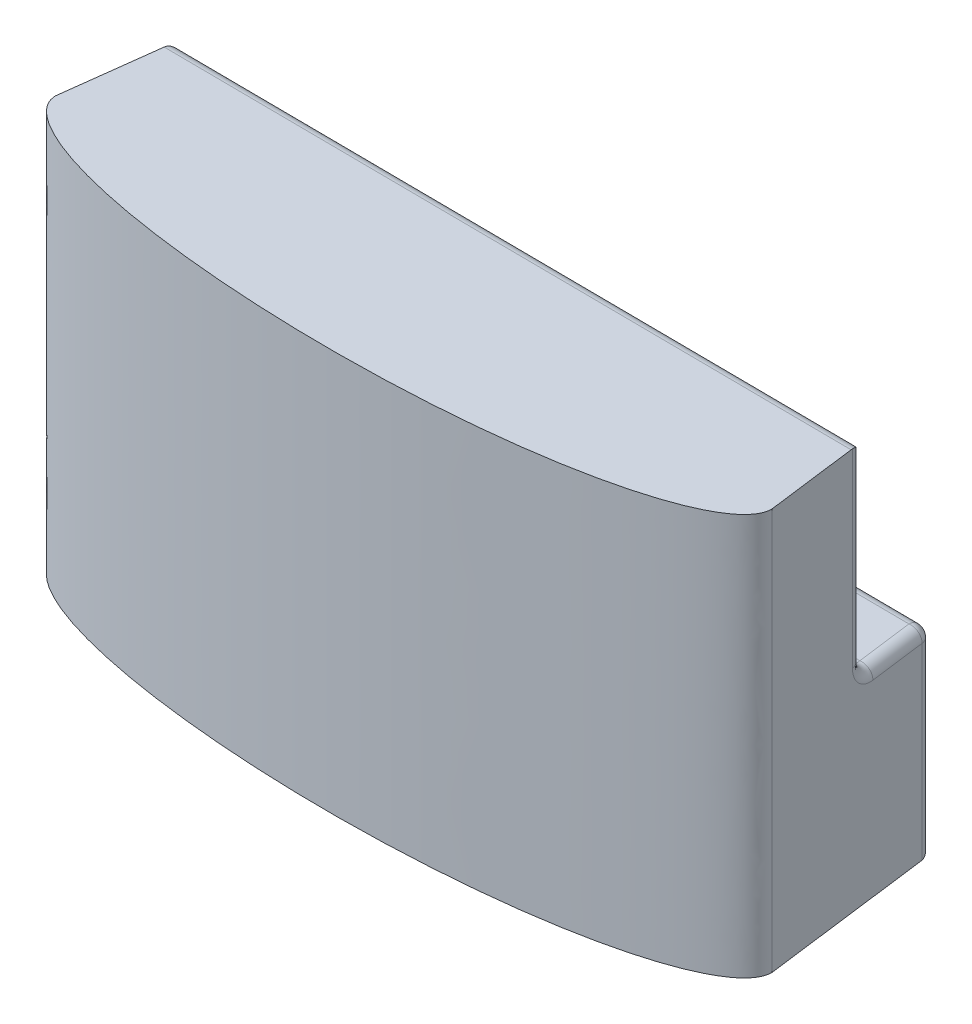
from build123d import *

# Parameters (mm, degrees)
BOSS_EXTRUDE1_DEPTH = 171
SKETCH2_W           = 285.008501173
SKETCH2_H           = 86
CUT_EXTRUDE1_DEPTH  = 34
SKETCH2_4_W         = 9.911182985
SKETCH2_4_H         = 86
CUT_EXTRUDE3_DEPTH  = 34
FILLET2_R           = 5


with BuildPart() as part:
    # Sketch1 → Boss-Extrude1 (new body)
    with BuildSketch(Plane(origin=(0, 0, 0), x_dir=(1, 0, 0), z_dir=(0, 1, 0))):
        with BuildLine():
            Line((-142.5, 80), (-152.5, 0))
            add(Edge.make_bspline(
                [(-152.5, 0), (-152.5, -35.105695045), (0, -35.105695045), (152.5, -35.105695045), (152.5, 0)],
                knots=[3.141592654, 3.141592654, 3.141592654, 4.71238898, 4.71238898, 6.283185307, 6.283185307, 6.283185307], degree=2, weights=[1, 0.707106781, 1, 0.707106781, 1]))
            Line((152.5, 0), (142.5, 77.798695585))
            Line((142.5, 77.798695585), (-142.5, 80))
        make_face()
    extrude(amount=BOSS_EXTRUDE1_DEPTH)

    # Sketch2 → Cut-Extrude1 (cut)
    with BuildSketch(Plane(origin=(0.609372357, 0, -78.894641077), x_dir=(-0.999970172211013, 0, -0.00772364475341999), z_dir=(0.00772364475341999, 0, -0.999970172211013))):
        with Locations((0.609390534, 128)):
            Rectangle(SKETCH2_W, SKETCH2_H)
    extrude(amount=-CUT_EXTRUDE1_DEPTH, mode=Mode.SUBTRACT)

    # Sketch2<4> → Cut-Extrude3 (cut)
    with BuildSketch(Plane(origin=(0.609372357, 0, -78.894641077), x_dir=(-0.999970172211013, 0, -0.00772364475341999), z_dir=(0.00772364475341999, 0, -0.999970172211013))):
        Polygon((-152.3840102, 85), (-141.894860053, 85), (-141.894860053, 171), (-152.3840102, 171.36474149), align=None)
        with Locations((148.069232613, 128)):
            Rectangle(SKETCH2_4_W, SKETCH2_4_H)
    extrude(amount=-CUT_EXTRUDE3_DEPTH, mode=Mode.SUBTRACT)

    # Fillet2
    fillet2_edges = [part.edges().sort_by_distance(p)[0] for p in [
        (146.874726821, 128, -43.763891566),
        (-146.746027299, 128, -46.03178161),
        (-142.5, 42.5, -80),
        (0, 0, -78.899347793),
        (142.5, 42.5, -77.798695585),
        (0, 85, -78.899347793),
        (0.064349761, 171, -44.897836588),
        (144.68736341, 85, -60.781293576),
        (-144.623013649, 85, -63.015890805),
        (0.064349761, 85, -44.897836588),
    ]]
    fillet(fillet2_edges, radius=FILLET2_R)


solid = part.part
